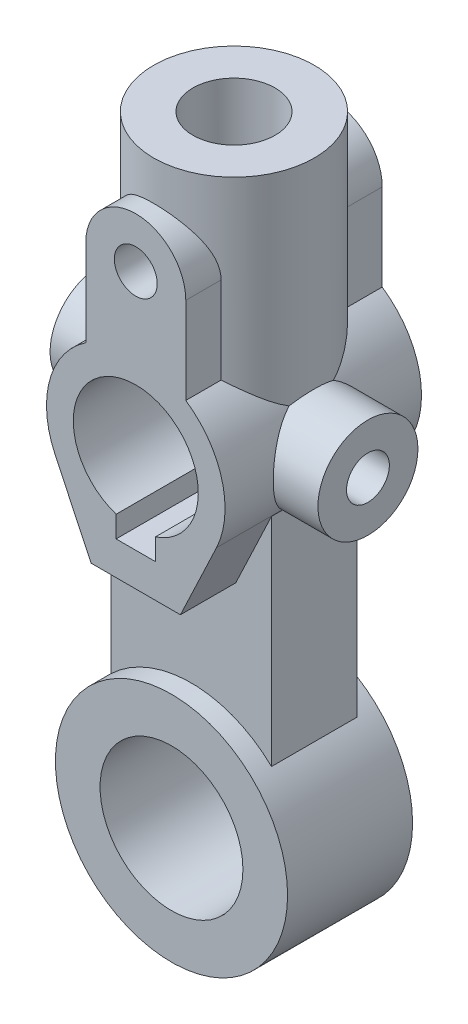
from build123d import *

# Parameters (mm, degrees)
SKETCH1_R           = 32.5
SKETCH1_R_2         = 20
EXTRUDE1_DEPTH      = 17.5
EXTRUDE2_REACH      = 134.736
EXTRUDE2_END_RADIUS = 32.5
SKETCH2_W           = 45
SKETCH2_H           = 24
SKETCH3_R           = 22.5
EXTRUDE3_DEPTH      = 70
EXTRUDE4_DEPTH      = 27.5
SKETCH5_R           = 14
EXTRUDE5_DEPTH      = 37.5
SKETCH6_R           = 6
EXTRUDE6_DEPTH      = 151.457635301
SKETCH7_R           = 6
EXTRUDE7_DEPTH      = 144.831498701
EXTRUDE8_DEPTH      = 144.831498701
SKETCH9_R           = 11.5
EXTRUDE9_DEPTH      = 136.715695529


with BuildPart() as part:
    # Sketch1 → Extrude1 (new, symmetric)
    with BuildSketch(Plane.XY):
        with Locations((0, -95)):
            Circle(SKETCH1_R)
        with Locations((0, -95)):
            Circle(SKETCH1_R_2, mode=Mode.SUBTRACT)
    extrude(amount=EXTRUDE1_DEPTH, both=True)

    # Extrude2: up to this cylinder (the profile starts outside it)
    extrude2_end = Plane(origin=(0, -95, 0), z_dir=(0, 0, -1)) * Cylinder(EXTRUDE2_END_RADIUS, 335.472, mode=Mode.PRIVATE)
    # Sketch2 → Extrude2 (add, up to the surface)
    with BuildSketch(Plane(origin=(0, 0, 0), x_dir=(1, 0, 0), z_dir=(0, 1, 0)), mode=Mode.PRIVATE) as extrude2_sk1:
        Rectangle(SKETCH2_W, SKETCH2_H)
    extrude2_tool1 = extrude(extrude2_sk1.sketch, amount=-EXTRUDE2_REACH, mode=Mode.PRIVATE) - extrude2_end
    add(extrude2_tool1.solids().sort_by_distance((0, 0, 0))[0])

    # Sketch3 → Extrude3 (add)
    with BuildSketch(Plane(origin=(0, 0, 0), x_dir=(1, 0, 0), z_dir=(0, 1, 0))):
        with Locations(Location((0, 0, 0), (0, 0, 32.230952636))):
            Circle(SKETCH3_R)
    extrude(amount=EXTRUDE3_DEPTH)

    # Sketch4 → Extrude4 (add, symmetric)
    with BuildSketch(Plane.XY):
        with BuildLine():
            Line((-12.5, -32), (12.5, -32))
            Line((12.5, -32), (22.59139561, -10.70648609))
            ThreePointArc((22.59139561, -10.70648609), (24.114680724, 6.594101422), (14, 20.712315177))
            Line((14, 20.712315177), (14, 45))
            ThreePointArc((14, 45), (0, 59), (-14, 45))
            Line((-14, 45), (-14, 20.712315177))
            ThreePointArc((-14, 20.712315177), (-24.114680724, 6.594101422), (-22.59139561, -10.70648609))
            Line((-22.59139561, -10.70648609), (-12.5, -32))
        make_face()
    extrude(amount=EXTRUDE4_DEPTH, both=True)

    # Sketch5 → Extrude5 (add, symmetric)
    with BuildSketch(Plane(origin=(0, 0, 0), x_dir=(0, 0, -1), z_dir=(1, 0, 0))):
        with Locations(Location((0, 0, 0), (0, 0, 229.884667682))):
            Circle(SKETCH5_R)
    extrude(amount=EXTRUDE5_DEPTH, both=True)

    # Sketch6 → Extrude6 (cut, through all)
    with BuildSketch(Plane(origin=(37.5, 0, 0), x_dir=(0, 0, -1), z_dir=(1, 0, 0))):
        Circle(SKETCH6_R)
    extrude(amount=-EXTRUDE6_DEPTH, mode=Mode.SUBTRACT)

    # Sketch7 → Extrude7 (cut, through all)
    with BuildSketch(Plane.XY.offset(27.5)):
        with Locations((0, 45)):
            Circle(SKETCH7_R)
    extrude(amount=-EXTRUDE7_DEPTH, mode=Mode.SUBTRACT)

    # Sketch8 → Extrude8 (cut, through all)
    with BuildSketch(Plane.XY.offset(27.5)):
        with BuildLine():
            Line((-5.5, -16.613247726), (-5.5, -22.613247726))
            Line((-5.5, -22.613247726), (5.5, -22.613247726))
            Line((5.5, -22.613247726), (5.5, -16.613247726))
            ThreePointArc((5.5, -16.613247726), (0, 17.5), (-5.5, -16.613247726))
        make_face()
    extrude(amount=-EXTRUDE8_DEPTH, mode=Mode.SUBTRACT)

    # Sketch9 → Extrude9 (cut, through all)
    with BuildSketch(Plane(origin=(0, 0, 0), x_dir=(1, 0, 0), z_dir=(0, 1, 0))):
        with Locations(Location((0, 0, 0), (0, 0, 90))):
            Circle(SKETCH9_R)
    extrude(amount=EXTRUDE9_DEPTH, mode=Mode.SUBTRACT)


solid = part.part
